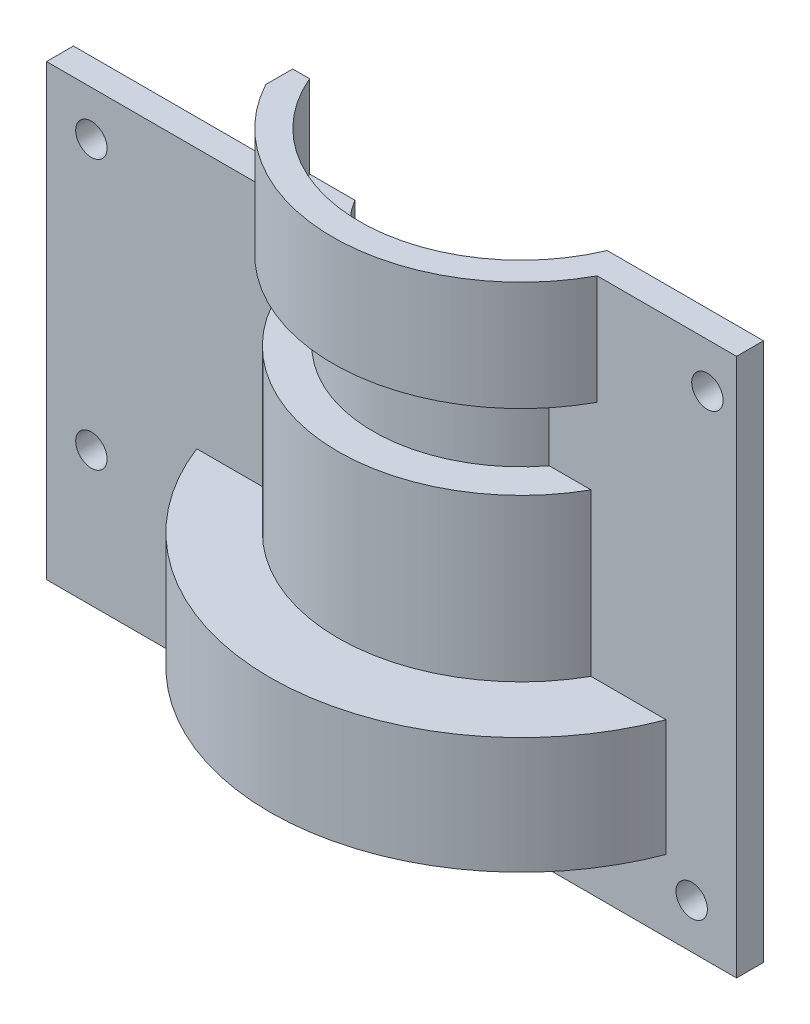
from build123d import *

# Parameters (mm, degrees)
SCHIZZO1_W                   = 76.9
SCHIZZO1_H                   = 60
ESTRUSIONE_ESTRUSIONE1_DEPTH = 3
RIVOLUZIONE2_ANGLE           = 180
SCHIZZO3_W                   = 82.857519441
SCHIZZO3_H                   = 19.07586099
TAGLIO_ESTRUSIONE1_DEPTH     = 87.921415247
SCHIZZO8_W                   = 15.498915434
SCHIZZO8_H                   = 3
SCHIZZO5_W                   = 31.459803045
SCHIZZO5_H                   = 71.75772661
TAGLIO_ESTRUSIONE2_DEPTH     = 86.17399838
SCHIZZO6_W                   = 24.433814687
SCHIZZO6_H                   = 10
TAGLIO_ESTRUSIONE3_DEPTH     = 52.984637154
SCHIZZO7_R                   = 1.75
TAGLIO_ESTRUSIONE4_DEPTH     = 52.984637154


with BuildPart() as part:
    # Schizzo1 → Estrusione-Estrusione1 (new body)
    with BuildSketch(Plane.XY):
        Rectangle(SCHIZZO1_W, SCHIZZO1_H)
    extrude(amount=ESTRUSIONE_ESTRUSIONE1_DEPTH)

    # Schizzo2 → Rivoluzione2 (revolve)
    with BuildSketch(Plane(origin=(0, 0, -7), x_dir=(-1, 0, 0), z_dir=(0, 0, -1))):
        Polygon((-1.948915434, 34.651441941), (-1.948915434, -22), (23.55, -22), (23.55, -9), (15.95, -9), (15.95, 9), (12.05, 9), (12.05, 17.8), (16.55, 17.8), (16.55, 34.651441941), align=None)
    revolve(axis=Axis((4.45, 39.663918646, -7), (0, 1, 0)), revolution_arc=RIVOLUZIONE2_ANGLE)

    # Schizzo3 → Taglio-Estrusione1 (cut, through all)
    with BuildSketch(Plane(origin=(38.45, 0, 0), x_dir=(0, 0, -1), z_dir=(1, 0, 0))):
        with Locations((-0.84285559, 39.537930495)):
            Rectangle(SCHIZZO3_W, SCHIZZO3_H)
    extrude(amount=-TAGLIO_ESTRUSIONE1_DEPTH, mode=Mode.SUBTRACT)

    # Schizzo8 → Taglia-Rivoluzione1 (revolve, cut)
    with BuildSketch(Plane(origin=(0, 0, -7), x_dir=(-1, 0, 0), z_dir=(0, 0, -1))):
        Polygon((13.55, 20.8), (13.55, 27), (-1.948915434, 27), (-1.948915434, -19), (20.55, -19), (20.55, -12), (12.95, -12), (12.95, 6), (9.05, 6), (9.05, 20.8), align=None)
        with Locations((5.800542283, 28.5)):
            Rectangle(SCHIZZO8_W, SCHIZZO8_H)
    revolve(axis=Axis((4.45, 30, -7), (0, -1, 0)), mode=Mode.SUBTRACT)

    # Schizzo5 → Taglio-Estrusione2 (cut, through all)
    with BuildSketch(Plane(origin=(38.45, 0, 0), x_dir=(0, 0, -1), z_dir=(1, 0, 0))):
        with Locations((15.729901523, 13.341257692)):
            Rectangle(SCHIZZO5_W, SCHIZZO5_H)
    extrude(amount=-TAGLIO_ESTRUSIONE2_DEPTH, mode=Mode.SUBTRACT)

    # Schizzo6 → Taglio-Estrusione3 (cut, through all)
    with BuildSketch(Plane.XY.offset(3)):
        with Locations((-26.233092657, 25)):
            Rectangle(SCHIZZO6_W, SCHIZZO6_H)
    extrude(amount=-TAGLIO_ESTRUSIONE3_DEPTH, mode=Mode.SUBTRACT)

    # Schizzo7 → Taglio-Estrusione4 (cut, through all)
    with BuildSketch(Plane.XY.offset(3)):
        with Locations((-33.45, 15)):
            Circle(SCHIZZO7_R)
        with Locations((-33.45, -15)):
            Circle(SCHIZZO7_R)
        with Locations((33.45, -25)):
            Circle(SCHIZZO7_R)
        with Locations((35.2, 25)):
            Circle(SCHIZZO7_R)
    extrude(amount=-TAGLIO_ESTRUSIONE4_DEPTH, mode=Mode.SUBTRACT)


solid = part.part
